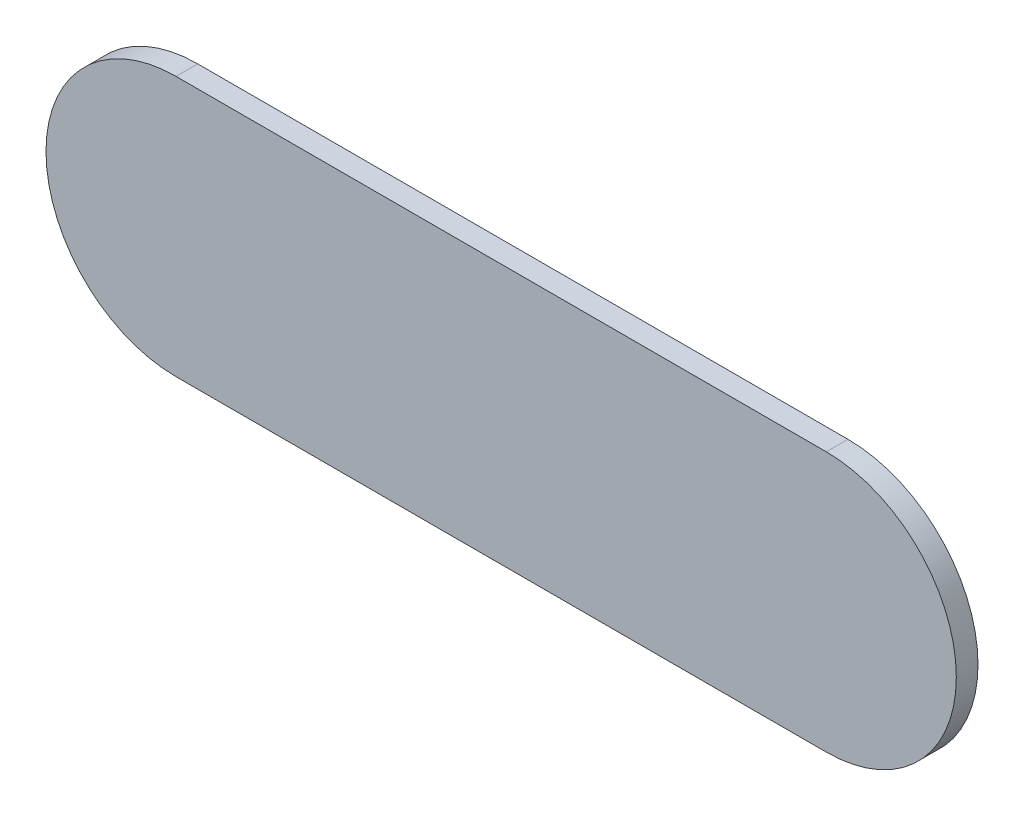
from build123d import *

# Parameters (mm, degrees)
BOSS_EXTRUDE1_DEPTH = 1


with BuildPart() as part:
    # Sketch1 → Boss-Extrude1 (new body)
    with BuildSketch(Plane.XY):
        with BuildLine():
            Line((-15, 6), (15, 6))
            ThreePointArc((15, 6), (21, 0), (15, -6))
            Line((15, -6), (-15, -6))
            ThreePointArc((-15, -6), (-21, 0), (-15, 6))
        make_face()
    extrude(amount=BOSS_EXTRUDE1_DEPTH)


solid = part.part
